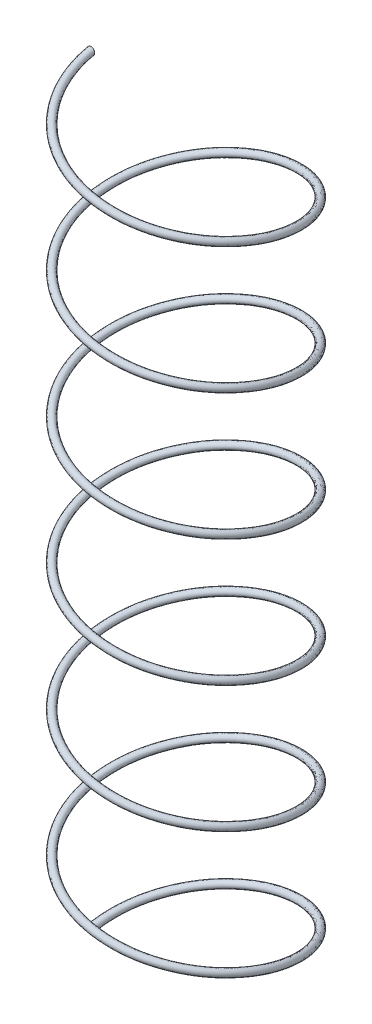
from build123d import *

# Parameters (mm, degrees)
SWEEP1_PITCH       = 5
SWEEP1_HEIGHT      = 30
SWEEP1_RADIUS      = 3.75
SWEEP1_START_ANGLE = -90
SKETCH2_R          = 0.147299509


with BuildPart() as part:
    # Sweep1: sweep along a helix
    with BuildLine() as sweep1_path:
        add(Helix(SWEEP1_PITCH, SWEEP1_HEIGHT, SWEEP1_RADIUS, center=(0, 0, 0), direction=(0, 1, 0), lefthand=True, mode=Mode.PRIVATE).rotate(Axis((0, 0, 0), (0, 1, 0)), SWEEP1_START_ANGLE))
    # Sketch2 → Sweep1 (sweep)
    with BuildSketch(Plane.XY):
        with Locations((-3.749330484, 0)):
            Circle(SKETCH2_R)
    sweep(path=sweep1_path.line, is_frenet=True)


solid = part.part
